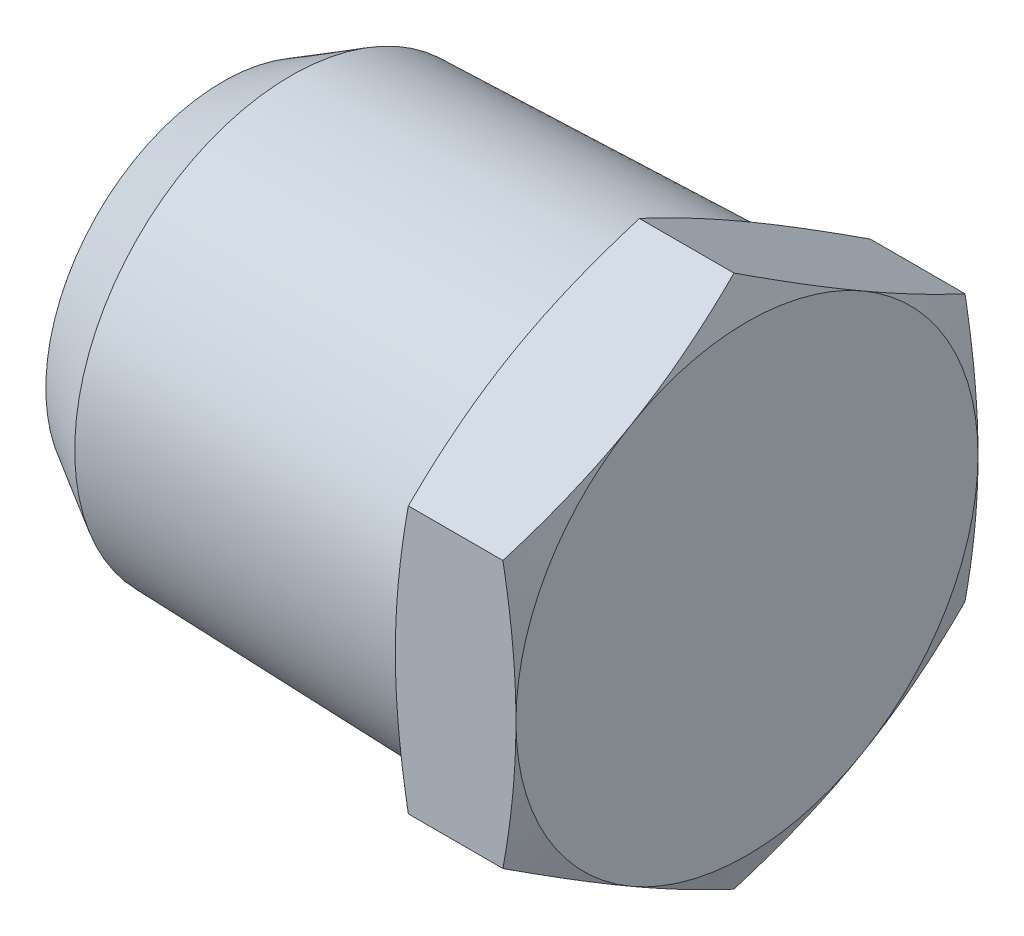
from build123d import *

# Parameters (mm, degrees)
SKETCH2_R          = 8.5725
EXTRUDE1_DEPTH     = 15.25524
EXTRUDE1_DRAFT     = -1.783333333
CHAMFER1_SIZE      = 1.411111111
CHAMFER1_SIZE2     = 2.584686345
EXTRUDE2_DEPTH     = 4.55676
SKETCH4_OUTSIDE_W  = 162.838
SKETCH4_OUTSIDE_H  = 165.54
SKETCH4_OUTSIDE_R  = 8.73125
CUT_EXTRUDE1_DEPTH = 24.882972442
CUT_EXTRUDE1_DRAFT = -70
SKETCH10_OUTSIDE_W = 142.948
SKETCH10_OUTSIDE_H = 145.65
SKETCH10_OUTSIDE_R = 8.73125
CUT_EXTRUDE2_DEPTH = 21.263350565
CUT_EXTRUDE2_DRAFT = -70


with BuildPart() as part:
    # Sketch2 → Extrude1 (with draft: the straight prism first)
    with BuildSketch(Plane(origin=(5.34924, 0, 0), x_dir=(0, 0, -1), z_dir=(1, 0, 0))):
        Circle(SKETCH2_R)
    extrude(amount=-EXTRUDE1_DEPTH)
    # Extrude1: the draft: its side faces are tilted about the plane it starts from
    extrude1_sides = [part.faces().sort_by_distance(p)[0] for p in [
        (-2.27838, 0, 8.5725),
    ]]
    draft(extrude1_sides, Plane(origin=(5.34924, 0, 0), x_dir=(0, 0, -1), z_dir=(1, 0, 0)), EXTRUDE1_DRAFT)

    # Chamfer1
    chamfer1_edges = [part.edges().sort_by_distance(p)[0] for p in [
        (-9.906, 0, 8.097526681),
    ]]
    chamfer1_side = [part.faces().sort_by_distance(p)[0] for p in [
        (-9.906, 0, 0),
    ]]
    chamfer(chamfer1_edges, length=CHAMFER1_SIZE, length2=CHAMFER1_SIZE2, reference=chamfer1_side[0])

    # Sketch3 → Extrude2 (add)
    with BuildSketch(Plane.ZY.offset(-5.34924)):
        Polygon((8.73125, 5.040989538), (0, 10.081979076), (-8.73125, 5.040989538), (-8.73125, -5.040989538), (0, -10.081979076), (8.73125, -5.040989538), align=None)
    extrude(amount=-EXTRUDE2_DEPTH)


with BuildPart() as cut_extrude1_tool:
    # Sketch4 outside → Cut-Extrude1 (with draft: the straight prism first)
    with BuildSketch(Plane(origin=(9.906, 0, 0), x_dir=(0, 0, -1), z_dir=(1, 0, 0))):
        Rectangle(SKETCH4_OUTSIDE_W, SKETCH4_OUTSIDE_H)
        Circle(SKETCH4_OUTSIDE_R, mode=Mode.SUBTRACT)
    extrude(amount=-CUT_EXTRUDE1_DEPTH)
    # Cut-Extrude1: the draft: its side faces are tilted about the plane it starts from
    cut_extrude1_sides = [cut_extrude1_tool.faces().sort_by_distance(p)[0] for p in [
        (-2.535486221, -82.77, 0),
        (-2.535486221, 0, -81.419),
        (-2.535486221, 82.77, 0),
        (-2.535486221, 0, 81.419),
        (-2.535486221, 0, 8.73125),
    ]]
    draft(cut_extrude1_sides, Plane(origin=(9.906, 0, 0), x_dir=(0, 0, -1), z_dir=(1, 0, 0)), CUT_EXTRUDE1_DRAFT)


with BuildPart() as part_1:
    add(part.part)

    # Cut-Extrude1: cut by cut_extrude1_tool
    add(cut_extrude1_tool.part, mode=Mode.SUBTRACT)


with BuildPart() as cut_extrude2_tool:
    # Sketch10 outside → Cut-Extrude2 (with draft: the straight prism first)
    with BuildSketch(Plane.ZY.offset(-5.34924)):
        Rectangle(SKETCH10_OUTSIDE_W, SKETCH10_OUTSIDE_H)
        Circle(SKETCH10_OUTSIDE_R, mode=Mode.SUBTRACT)
    extrude(amount=-CUT_EXTRUDE2_DEPTH)
    # Cut-Extrude2: the draft: its side faces are tilted about the plane it starts from
    cut_extrude2_sides = [cut_extrude2_tool.faces().sort_by_distance(p)[0] for p in [
        (15.980915282, -72.825, 0),
        (15.980915282, 0, 71.474),
        (15.980915282, 72.825, 0),
        (15.980915282, 0, -71.474),
        (15.980915282, 0, -8.73125),
    ]]
    draft(cut_extrude2_sides, Plane.ZY.offset(-5.34924), CUT_EXTRUDE2_DRAFT)


with BuildPart() as part_2:
    add(part_1.part)

    # Cut-Extrude2: cut by cut_extrude2_tool
    add(cut_extrude2_tool.part, mode=Mode.SUBTRACT)

    # Sketch12 → Cut-Revolve1 (revolve, cut)
    with BuildSketch(Plane.XY, mode=Mode.PRIVATE) as cut_revolve1_sk:
        Polygon((-9.906, 0), (6.735918438, 0), (3.302, 5.715), (-9.906, 5.715), align=None)
    revolve(cut_revolve1_sk.sketch.rotate(Axis((6.735918438, 0, 0), (1, 0, 0)), 180), axis=Axis((6.735918438, 0, 0), (1, 0, 0)), mode=Mode.SUBTRACT)


solid = part_2.part
